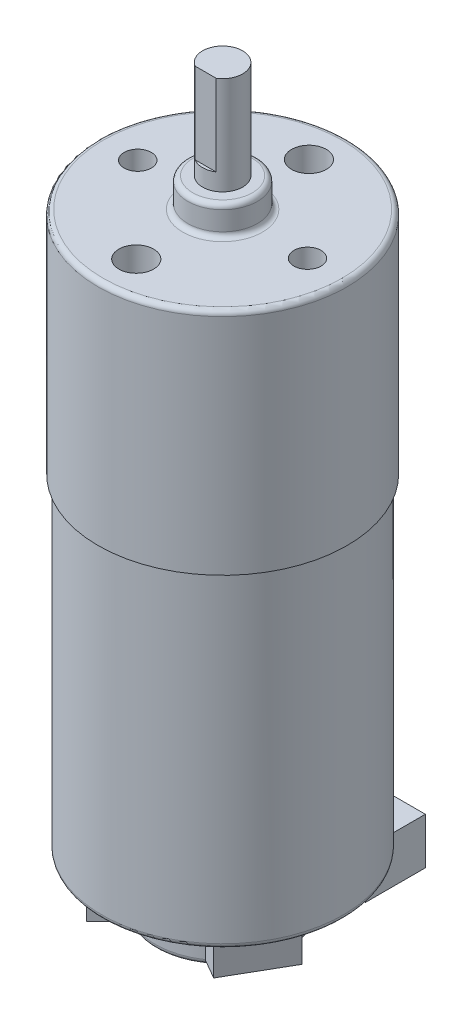
from build123d import *

# Parameters (mm, degrees)
CROQUIS1_R               = 12.065
SALIENTE_EXTRUIR1_DEPTH  = 31.01
CROQUIS2_R               = 12.44
SALIENTE_EXTRUIR2_DEPTH  = 22.88
SALIENTE_EXTRUIR3_START  = 1.63
CROQUIS3_R               = 12.065
SALIENTE_EXTRUIR3_DEPTH  = 1.63
CROQUIS4_R               = 3.475
SALIENTE_EXTRUIR4_DEPTH  = 2.91
CROQUIS5_R               = 2
SALIENTE_EXTRUIR5_DEPTH  = 9.8
CROQUIS6_R               = 6.725
SALIENTE_EXTRUIR6_DEPTH  = 5.22
SALIENTE_EXTRUIR7_DEPTH  = 3.83
CROQUIS9_W               = 13.9
CROQUIS9_H               = 6
SALIENTE_EXTRUIR8_DEPTH  = 4.64
CROQUIS12_W              = 8.04
CROQUIS12_H              = 4.476157342
CORTAR_EXTRUIR1_DEPTH    = 1
CROQUIS13_R              = 1.737199475
CROQUIS13_R_2            = 1.36
CORTAR_EXTRUIR2_DEPTH    = 10
CROQUIS15_W              = 12.7
CROQUIS15_H              = 3.44
CORTAR_EXTRUIR3_DEPTH    = 4.48
CROQUIS16_R              = 0.3
SALIENTE_EXTRUIR10_DEPTH = 4.38
REDONDEO1_R              = 0.5
REDONDEO2_R              = 0.5
CROQUIS17_W              = 3.997612493
CROQUIS17_H              = 8.11
CORTAR_EXTRUIR4_DEPTH    = 0.3


with BuildPart() as part:
    # Croquis1 → Saliente-Extruir1 (new body)
    with BuildSketch(Plane(origin=(0, 0, 0), x_dir=(1, 0, 0), z_dir=(0, 1, 0))):
        with Locations(Location((0, 0, 0), (0, 0, 270))):
            Circle(CROQUIS1_R)
    extrude(amount=SALIENTE_EXTRUIR1_DEPTH)

    # Croquis2 → Saliente-Extruir2 (add)
    with BuildSketch(Plane(origin=(0, 31.01, 0), x_dir=(1, 0, 0), z_dir=(0, 1, 0))):
        with Locations(Location((0, 0, 0), (0, 0, 270))):
            Circle(CROQUIS2_R)
    extrude(amount=SALIENTE_EXTRUIR2_DEPTH)

    # Croquis3 → Saliente-Extruir3 (add)
    with BuildSketch(Plane.XZ.offset(SALIENTE_EXTRUIR3_START)):
        with Locations(Location((0, 0, 0), (0, 0, 270))):
            Circle(CROQUIS3_R)
    extrude(amount=-SALIENTE_EXTRUIR3_DEPTH)

    # Croquis4 → Saliente-Extruir4 (add)
    with BuildSketch(Plane(origin=(0, 53.89, 0), x_dir=(1, 0, 0), z_dir=(0, 1, 0))):
        with Locations(Location((0, 0, 0), (0, 0, 270))):
            Circle(CROQUIS4_R)
    extrude(amount=SALIENTE_EXTRUIR4_DEPTH)

    # Croquis5 → Saliente-Extruir5 (add)
    with BuildSketch(Plane(origin=(0, 56.8, 0), x_dir=(1, 0, 0), z_dir=(0, 1, 0))):
        with Locations(Location((0, 0, 0), (0, 0, 270))):
            Circle(CROQUIS5_R)
    extrude(amount=SALIENTE_EXTRUIR5_DEPTH)

    # Croquis6 → Saliente-Extruir6 (add)
    with BuildSketch(Plane.XZ.offset(1.63)):
        with Locations(Location((0, 0, 0), (0, 0, 270))):
            Circle(CROQUIS6_R)
    extrude(amount=SALIENTE_EXTRUIR6_DEPTH)

    # Croquis7 → Saliente-Extruir7 (add)
    with BuildSketch(Plane.XZ.offset(1.63)):
        Polygon((-9.089313744, 4.521403938), (-4.521403938, 9.089313744), (-2.895058341, 7.462968148), (-7.462968148, 2.895058341), align=None)
        Polygon((9.946164384, 2.012737946), (6.716164384, 7.607262054), (4.724305956, 6.457262054), (7.954305956, 0.862737946), align=None)
    extrude(amount=SALIENTE_EXTRUIR7_DEPTH)

    # Croquis9 → Saliente-Extruir8 (add)
    with BuildSketch(Plane.XZ.offset(1.63)):
        with Locations((0, -10.3046092)):
            Rectangle(CROQUIS9_W, CROQUIS9_H)
    extrude(amount=SALIENTE_EXTRUIR8_DEPTH)

    # Croquis12 → Cortar-Extruir1 (cut)
    with BuildSketch(Plane.XZ.offset(6.27)):
        with Locations((0, -11.066530529)):
            Rectangle(CROQUIS12_W, CROQUIS12_H)
    extrude(amount=-CORTAR_EXTRUIR1_DEPTH, mode=Mode.SUBTRACT)

    # Croquis13 → Cortar-Extruir2 (cut)
    with BuildSketch(Plane(origin=(0, 53.89, 0), x_dir=(1, 0, 0), z_dir=(0, 1, 0))):
        with Locations(Location((0, 8.627800525, 0), (0, 0, 270))):
            Circle(CROQUIS13_R)
        with Locations(Location((-8.48, 0, 0), (0, 0, 270))):
            Circle(CROQUIS13_R_2)
        with Locations(Location((0, -8.627800525, 0), (0, 0, 90))):
            Circle(CROQUIS13_R)
        with Locations(Location((8.48, 0, 0), (0, 0, 90))):
            Circle(CROQUIS13_R_2)
    extrude(amount=-CORTAR_EXTRUIR2_DEPTH, mode=Mode.SUBTRACT)

    # Croquis15 → Cortar-Extruir3 (cut)
    with BuildSketch(Plane(origin=(0, 0, -13.3046092), x_dir=(-1, 0, 0), z_dir=(0, 0, -1))):
        with Locations((0, -3.95)):
            Rectangle(CROQUIS15_W, CROQUIS15_H)
    extrude(amount=-CORTAR_EXTRUIR3_DEPTH, mode=Mode.SUBTRACT)

    # Croquis16 → Saliente-Extruir10 (add)
    with BuildSketch(Plane(origin=(0, 0, -8.8246092), x_dir=(-1, 0, 0), z_dir=(0, 0, -1))):
        with Locations((-4.58, -3.93)):
            Circle(CROQUIS16_R)
        with Locations((-2.78, -3.93)):
            Circle(CROQUIS16_R)
        with Locations((-0.98, -3.93)):
            Circle(CROQUIS16_R)
        with Locations((0.82, -3.93)):
            Circle(CROQUIS16_R)
        with Locations((2.62, -3.93)):
            Circle(CROQUIS16_R)
        with Locations((4.42, -3.93)):
            Circle(CROQUIS16_R)
    extrude(amount=SALIENTE_EXTRUIR10_DEPTH)

    # Redondeo1
    redondeo1_edges = [part.edges().sort_by_distance(p)[0] for p in [
        (0, -1.63, 12.065),
        (0, 53.89, -3.475),
        (0, 56.8, -3.475),
        (0, 53.89, -12.44),
    ]]
    fillet(redondeo1_edges, radius=REDONDEO1_R)

    # Redondeo2
    redondeo2_edges = [part.edges().sort_by_distance(p)[0] for p in [
        (0, -6.85, 6.725),
    ]]
    fillet(redondeo2_edges, radius=REDONDEO2_R)

    # Croquis17 → Cortar-Extruir4 (cut)
    with BuildSketch(Plane.XY.offset(2)):
        with Locations((0.001193753, 62.545)):
            Rectangle(CROQUIS17_W, CROQUIS17_H)
    extrude(amount=-CORTAR_EXTRUIR4_DEPTH, mode=Mode.SUBTRACT)


solid = part.part
